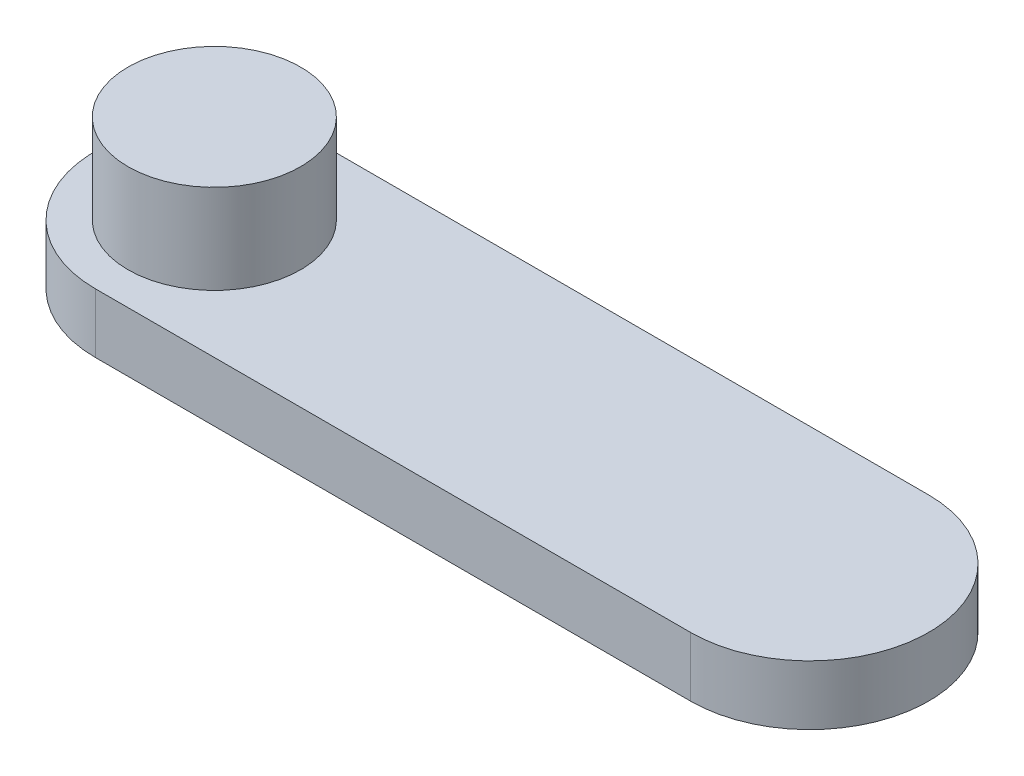
from build123d import *

# Parameters (mm, degrees)
BOSS_EXTRUDE2_DEPTH = 10
SKETCH2_R           = 14.5
BOSS_EXTRUDE3_DEPTH = 15


with BuildPart() as part:
    # Sketch1 → Boss-Extrude2 (new body)
    with BuildSketch(Plane(origin=(0, 0, 0), x_dir=(1, 0, 0), z_dir=(0, 1, 0))):
        with BuildLine():
            Line((-45.740165089, 20), (54.259834911, 20))
            ThreePointArc((54.259834911, 20), (74.259834911, 0), (54.259834911, -20))
            Line((54.259834911, -20), (-45.740165089, -20))
            ThreePointArc((-45.740165089, -20), (-65.740165089, 0), (-45.740165089, 20))
        make_face()
    extrude(amount=BOSS_EXTRUDE2_DEPTH)

    # Sketch2 → Boss-Extrude3 (add)
    with BuildSketch(Plane(origin=(0, 10, 0), x_dir=(1, 0, 0), z_dir=(0, 1, 0))):
        with Locations(Location((-45.740165089, 0, 0), (0, 0, 270))):
            Circle(SKETCH2_R)
    extrude(amount=BOSS_EXTRUDE3_DEPTH)


solid = part.part
